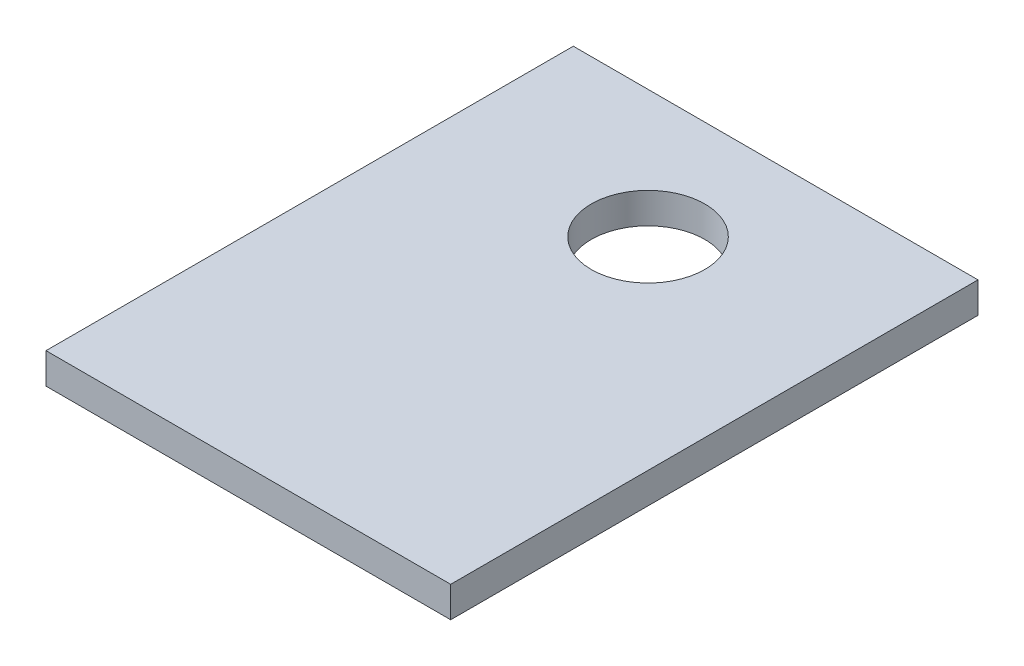
from build123d import *

# Parameters (mm, degrees)
SKETCH1_W           = 65.813265526
SKETCH1_H           = 85.754192612
SKETCH1_R           = 9.23643322
BOSS_EXTRUDE1_DEPTH = 5


with BuildPart() as part:
    # Sketch1 → Boss-Extrude1 (new body)
    with BuildSketch(Plane(origin=(0, 0, 0), x_dir=(1, 0, 0), z_dir=(0, 1, 0))):
        with Locations((32.906632763, 42.877096306)):
            Rectangle(SKETCH1_W, SKETCH1_H)
        with Locations(Location((32.906632763, 65, 0), (0, 0, 270))):
            Circle(SKETCH1_R, mode=Mode.SUBTRACT)
    extrude(amount=BOSS_EXTRUDE1_DEPTH)


solid = part.part
